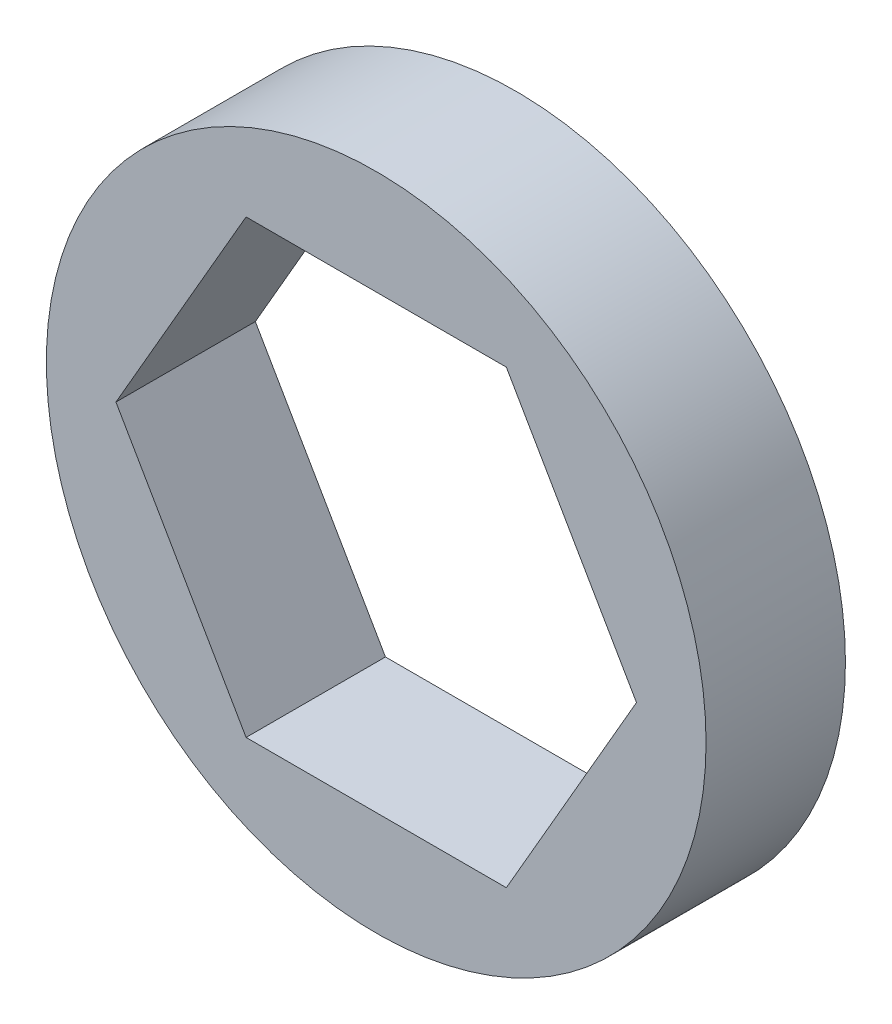
from build123d import *

# Parameters (mm, degrees)
SKETCH1_R           = 9.525
BOSS_EXTRUDE1_DEPTH = 4.025


with BuildPart() as part:
    # Sketch1 → Boss-Extrude1 (new body)
    with BuildSketch(Plane.XY):
        Circle(SKETCH1_R)
        Polygon((7.515657129, 0), (3.757828565, 6.50875), (-3.757828565, 6.50875), (-7.515657129, 0), (-3.757828565, -6.50875), (3.757828565, -6.50875), align=None, mode=Mode.SUBTRACT)
    extrude(amount=BOSS_EXTRUDE1_DEPTH)


solid = part.part
